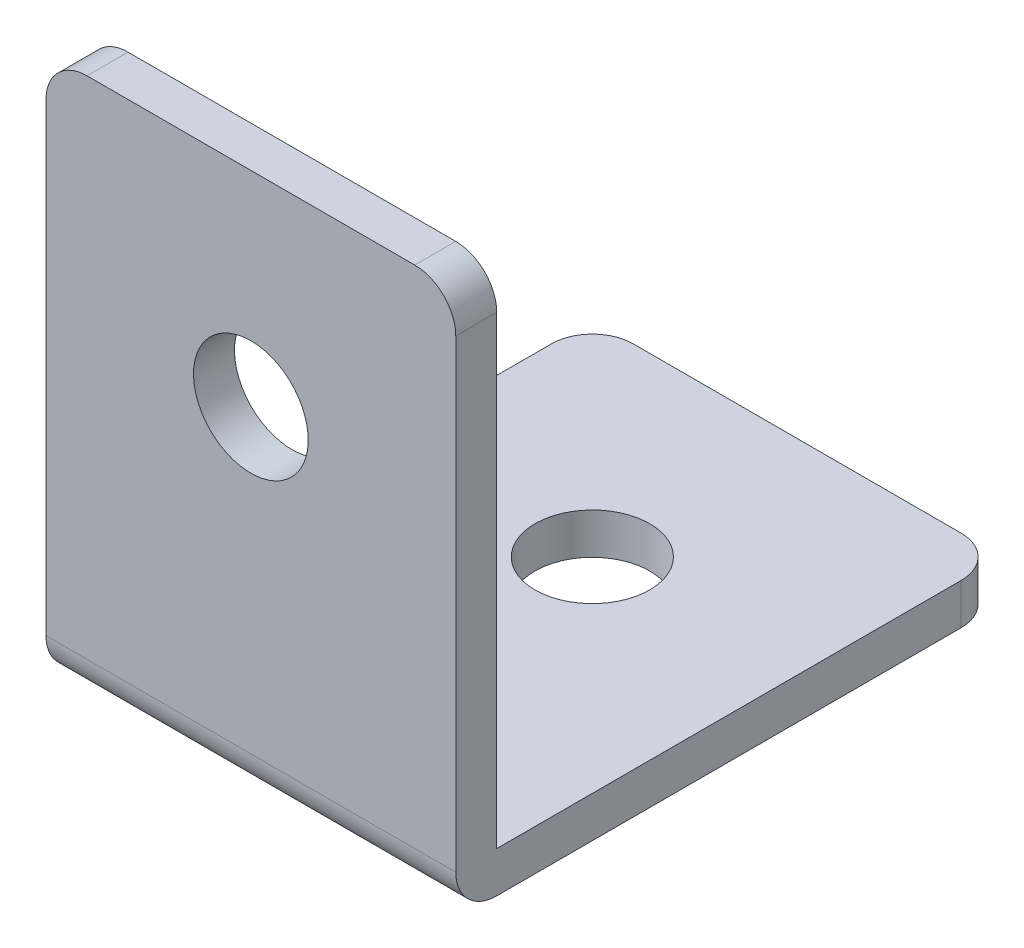
from build123d import *

# Parameters (mm, degrees)
EXTRUDE_THIN1_DEPTH        = 15
F_4_2_4_2_DIAMETER_HOLE1_D = 4.2
F_4_2_4_2_DIAMETER_HOLE2_D = 4.2
FILLET1_R                  = 1.5


with BuildPart() as part:
    # Sketch1 → Extrude-Thin1 (new body)
    with BuildSketch(Plane(origin=(0, 0, 0), x_dir=(0, 0, -1), z_dir=(1, 0, 0))):
        with BuildLine():
            Line((0, 20), (0, 1.5))
            ThreePointArc((0, 1.5), (0.439339828, 0.439339828), (1.5, 0))
            Line((1.5, 0), (20, 0))
            Line((20, 0), (20, 1.5))
            Line((20, 1.5), (1.5, 1.5))
            Line((1.5, 1.5), (1.5, 20))
            Line((1.5, 20), (0, 20))
        make_face()
    extrude(amount=EXTRUDE_THIN1_DEPTH)

    # Ø4.2 (4.2) Diameter Hole1 (through all)
    with Locations(Plane(origin=(0, 1.5, 0), x_dir=(1, 0, 0), z_dir=(0, 1, 0))):
        with Locations((7.5, 12.5)):
            Hole(F_4_2_4_2_DIAMETER_HOLE1_D / 2)

    # Ø4.2 (4.2) Diameter Hole2 (through all)
    with Locations(Plane(origin=(0, 0, -1.5), x_dir=(-1, 0, 0), z_dir=(0, 0, -1))):
        with Locations((-7.5, 12.5)):
            Hole(F_4_2_4_2_DIAMETER_HOLE2_D / 2)

    # Fillet1
    fillet1_edges = [part.edges().sort_by_distance(p)[0] for p in [
        (15, 20, -0.75),
        (0, 20, -0.75),
        (15, 0.75, -20),
        (0, 0.75, -20),
    ]]
    fillet(fillet1_edges, radius=FILLET1_R)


solid = part.part
